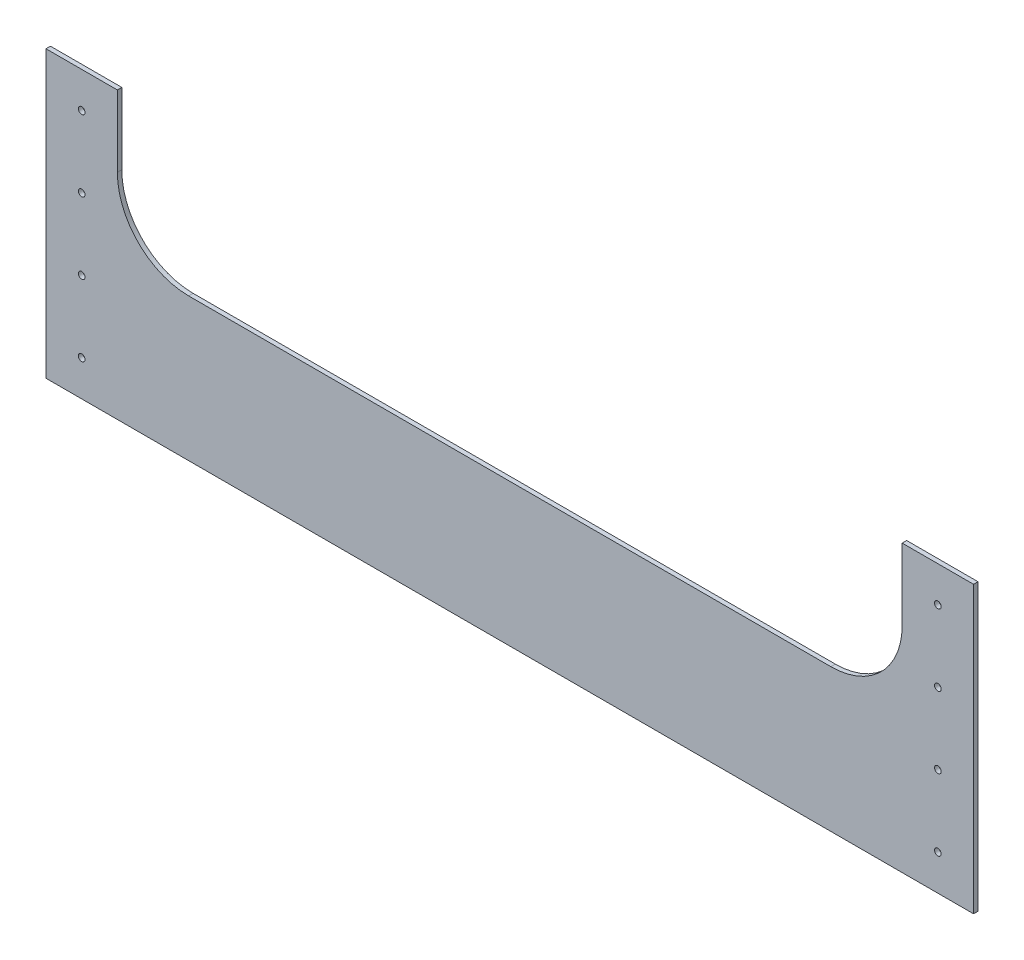
from build123d import *

# Parameters (mm, degrees)
SKETCH1_R           = 2.38125
BOSS_EXTRUDE1_DEPTH = 3.175


with BuildPart() as part:
    # Sketch1 → Boss-Extrude1 (new body)
    with BuildSketch(Plane.XY):
        with BuildLine():
            Line((330.2, 0), (-330.2, 0))
            Line((-330.2, 0), (-330.2, 203.2))
            Line((-330.2, 203.2), (-279.4, 203.2))
            Line((-279.4, 203.2), (-279.4, 152.4))
            ThreePointArc((-279.4, 152.4), (-264.521024484, 116.478975516), (-228.6, 101.6))
            Line((-228.6, 101.6), (228.6, 101.6))
            ThreePointArc((228.6, 101.6), (264.521024484, 116.478975516), (279.4, 152.4))
            Line((279.4, 152.4), (279.4, 203.2))
            Line((279.4, 203.2), (330.2, 203.2))
            Line((330.2, 203.2), (330.2, 0))
        make_face()
        with Locations((-304.8, 177.8)):
            Circle(SKETCH1_R, mode=Mode.SUBTRACT)
        with Locations((-304.8, 127)):
            Circle(SKETCH1_R, mode=Mode.SUBTRACT)
        with Locations((-304.8, 76.2)):
            Circle(SKETCH1_R, mode=Mode.SUBTRACT)
        with Locations((-304.8, 25.4)):
            Circle(SKETCH1_R, mode=Mode.SUBTRACT)
        with Locations((304.8, 177.8)):
            Circle(SKETCH1_R, mode=Mode.SUBTRACT)
        with Locations((304.8, 127)):
            Circle(SKETCH1_R, mode=Mode.SUBTRACT)
        with Locations((304.8, 76.2)):
            Circle(SKETCH1_R, mode=Mode.SUBTRACT)
        with Locations((304.8, 25.4)):
            Circle(SKETCH1_R, mode=Mode.SUBTRACT)
    extrude(amount=BOSS_EXTRUDE1_DEPTH)


solid = part.part
